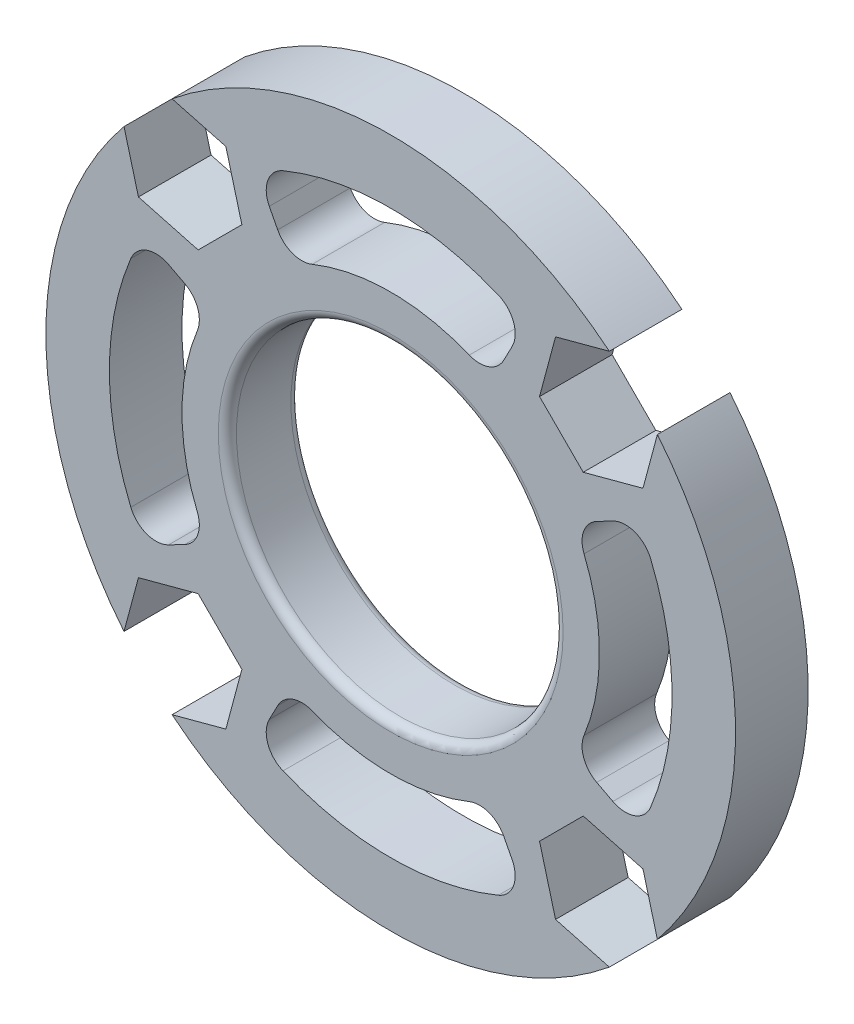
from build123d import *

# Parameters (mm, degrees)
SKETCH1_R           = 19
SKETCH1_R_2         = 9
BOSS_EXTRUDE1_DEPTH = 4
CUT_EXTRUDE1_DEPTH  = 4
FILLET1_R           = 0.5


with BuildPart() as part:
    # Sketch1 → Boss-Extrude1 (new body)
    with BuildSketch(Plane.XY):
        Circle(SKETCH1_R)
        Circle(SKETCH1_R_2, mode=Mode.SUBTRACT)
        with BuildLine():
            Line((6.689691504, 12.241024694), (6.226047976, 11.350373764))
            ThreePointArc((6.226047976, 11.350373764), (5.41320923, 10.635157913), (4.330662681, 10.653420143))
            ThreePointArc((4.330662681, 10.653420143), (0, 11.5), (-4.330662681, 10.653420143))
            ThreePointArc((-4.330662681, 10.653420143), (-5.41320923, 10.635157913), (-6.226047976, 11.350373764))
            Line((-6.226047976, 11.350373764), (-6.689691504, 12.241024694))
            ThreePointArc((-6.689691504, 12.241024694), (-6.768746058, 13.446590252), (-5.933372603, 14.319395572))
            ThreePointArc((-5.933372603, 14.319395572), (0, 15.5), (5.933372603, 14.319395572))
            ThreePointArc((5.933372603, 14.319395572), (6.768746058, 13.446590252), (6.689691504, 12.241024694))
        make_face(mode=Mode.SUBTRACT)
        with BuildLine():
            Line((12.241024694, 6.689691504), (11.350373764, 6.226047976))
            ThreePointArc((11.350373764, 6.226047976), (10.635157913, 5.41320923), (10.653420143, 4.330662681))
            ThreePointArc((10.653420143, 4.330662681), (11.5, 0), (10.653420143, -4.330662681))
            ThreePointArc((10.653420143, -4.330662681), (10.635157913, -5.41320923), (11.350373764, -6.226047976))
            Line((11.350373764, -6.226047976), (12.241024694, -6.689691504))
            ThreePointArc((12.241024694, -6.689691504), (13.446590252, -6.768746058), (14.319395572, -5.933372603))
            ThreePointArc((14.319395572, -5.933372603), (15.5, 0), (14.319395572, 5.933372603))
            ThreePointArc((14.319395572, 5.933372603), (13.446590252, 6.768746058), (12.241024694, 6.689691504))
        make_face(mode=Mode.SUBTRACT)
        with BuildLine():
            Line((6.689691504, -12.241024694), (6.226047976, -11.350373764))
            ThreePointArc((6.226047976, -11.350373764), (5.41320923, -10.635157913), (4.330662681, -10.653420143))
            ThreePointArc((4.330662681, -10.653420143), (0, -11.5), (-4.330662681, -10.653420143))
            ThreePointArc((-4.330662681, -10.653420143), (-5.41320923, -10.635157913), (-6.226047976, -11.350373764))
            Line((-6.226047976, -11.350373764), (-6.689691504, -12.241024694))
            ThreePointArc((-6.689691504, -12.241024694), (-6.768746058, -13.446590252), (-5.933372603, -14.319395572))
            ThreePointArc((-5.933372603, -14.319395572), (0, -15.5), (5.933372603, -14.319395572))
            ThreePointArc((5.933372603, -14.319395572), (6.768746058, -13.446590252), (6.689691504, -12.241024694))
        make_face(mode=Mode.SUBTRACT)
        with BuildLine():
            Line((-12.241024694, -6.689691504), (-11.350373764, -6.226047976))
            ThreePointArc((-11.350373764, -6.226047976), (-10.635157913, -5.41320923), (-10.653420143, -4.330662681))
            ThreePointArc((-10.653420143, -4.330662681), (-11.5, 0), (-10.653420143, 4.330662681))
            ThreePointArc((-10.653420143, 4.330662681), (-10.635157913, 5.41320923), (-11.350373764, 6.226047976))
            Line((-11.350373764, 6.226047976), (-12.241024694, 6.689691504))
            ThreePointArc((-12.241024694, 6.689691504), (-13.446590252, 6.768746058), (-14.319395572, 5.933372603))
            ThreePointArc((-14.319395572, 5.933372603), (-15.5, 0), (-14.319395572, -5.933372603))
            ThreePointArc((-14.319395572, -5.933372603), (-13.446590252, -6.768746058), (-12.241024694, -6.689691504))
        make_face(mode=Mode.SUBTRACT)
    extrude(amount=BOSS_EXTRUDE1_DEPTH)

    # Sketch2 → Cut-Extrude1 (cut)
    with BuildSketch(Plane(origin=(0, 0, 0), x_dir=(-1, 0, 0), z_dir=(0, 0, -1))):
        Polygon((10.608852647, -8.200187733), (8.200187733, -10.608852647), (9.081820281, -13.899150108), (12.372117742, -14.780782656), (14.780782656, -12.372117742), (13.899150108, -9.081820281), align=None)
        Polygon((13.899150108, 9.081820281), (14.780782656, 12.372117742), (12.372117742, 14.780782656), (9.081820281, 13.899150108), (8.200187733, 10.608852647), (10.608852647, 8.200187733), align=None)
        Polygon((-8.200187733, -10.608852647), (-10.608852647, -8.200187733), (-13.899150108, -9.081820281), (-14.780782656, -12.372117742), (-12.372117742, -14.780782656), (-9.081820281, -13.899150108), align=None)
        Polygon((-10.608852647, 8.200187733), (-8.200187733, 10.608852647), (-9.081820281, 13.899150108), (-12.372117742, 14.780782656), (-14.780782656, 12.372117742), (-13.899150108, 9.081820281), align=None)
    extrude(amount=-CUT_EXTRUDE1_DEPTH, mode=Mode.SUBTRACT)

    # Fillet1
    fillet1_edges = [part.edges().sort_by_distance(p)[0] for p in [
        (-9, 0, 0),
        (-9, 0, 4),
    ]]
    fillet(fillet1_edges, radius=FILLET1_R)


solid = part.part
